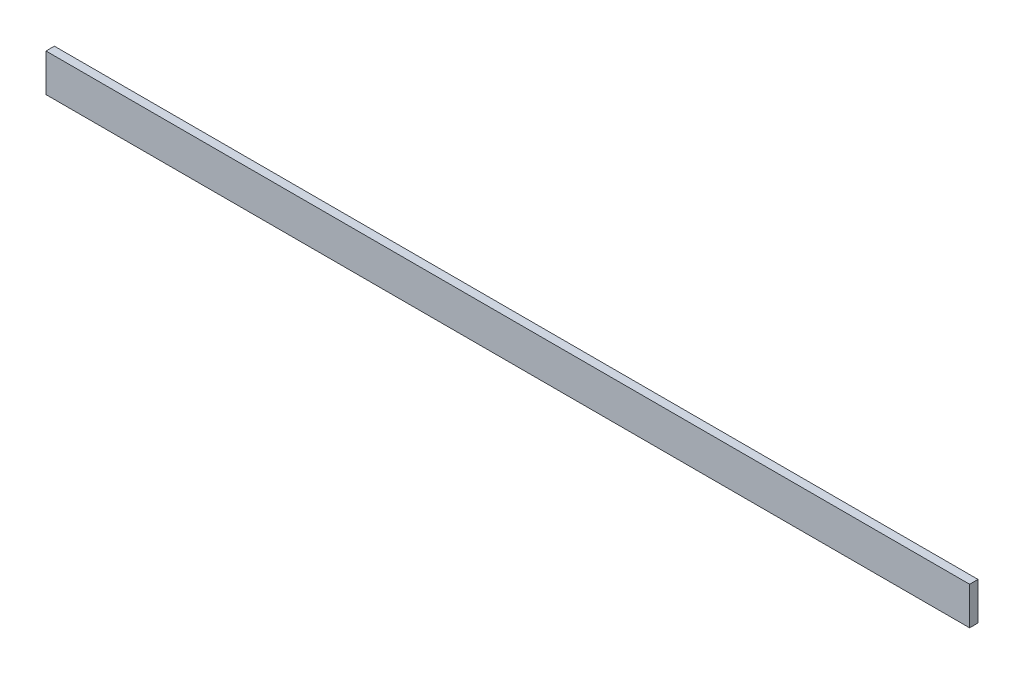
from build123d import *

# Parameters (mm, degrees)
ESQUISSE1_W        = 2200
ESQUISSE1_H        = 90
BOSS_EXTRU_1_DEPTH = 20


with BuildPart() as part:
    # Esquisse1 → Boss.-Extru.1 (new body)
    with BuildSketch(Plane.XY):
        with Locations((976.378879379, -10.20015202)):
            Rectangle(ESQUISSE1_W, ESQUISSE1_H)
    extrude(amount=BOSS_EXTRU_1_DEPTH)


solid = part.part
